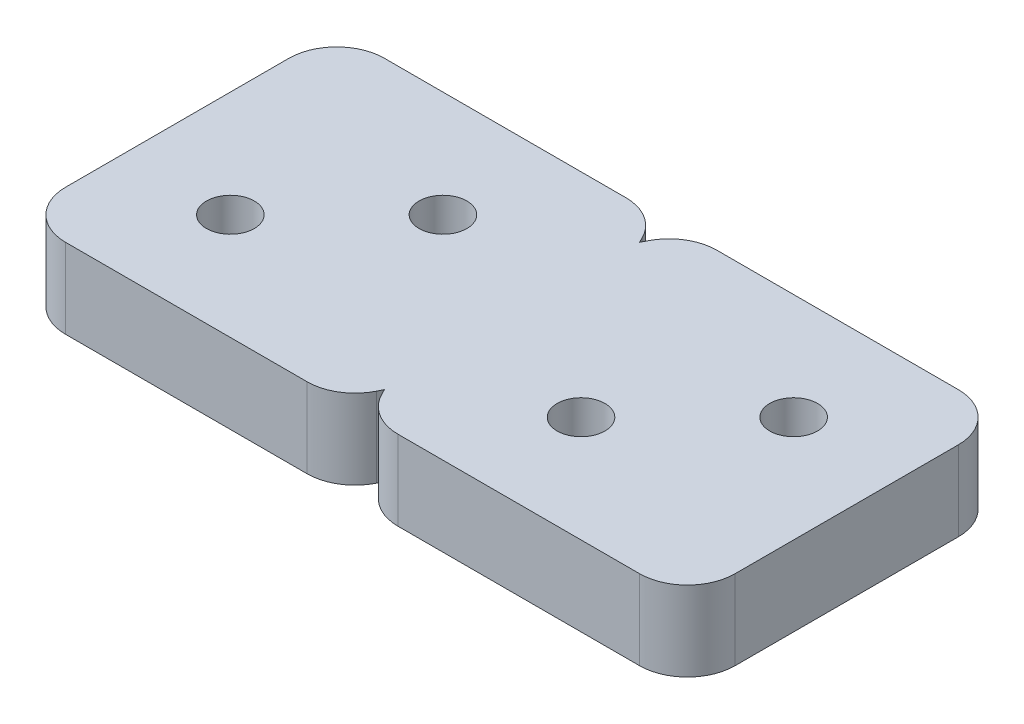
from build123d import *

# Parameters (mm, degrees)
SKETCH1_R           = 1.905
BOSS_EXTRUDE1_DEPTH = 6.35
FILLET1_R           = 3.81


with BuildPart() as part:
    # Sketch1 → Boss-Extrude1 (new body)
    with BuildSketch(Plane(origin=(0, 0, 0), x_dir=(1, 0, 0), z_dir=(0, 1, 0))):
        Polygon((-51.164237676, -4.231087287), (-51.164237676, -29.631087287), (-25.764237676, -29.631087287), (-24.494237676, -27.091087287), (-23.224237676, -29.631087287), (2.175762324, -29.631087287), (2.175762324, -4.231087287), (-23.224237676, -4.231087287), (-24.494237676, -6.771087287), (-25.764237676, -4.231087287), align=None)
        with Locations(Location((-42.698849573, -21.165699184, 0), (0, 0, 270))):
            Circle(SKETCH1_R, mode=Mode.SUBTRACT)
        with Locations(Location((-34.22962578, -12.696475391, 0), (0, 0, 270))):
            Circle(SKETCH1_R, mode=Mode.SUBTRACT)
        with Locations(Location((-14.758849573, -21.165699184, 0), (0, 0, 270))):
            Circle(SKETCH1_R, mode=Mode.SUBTRACT)
        with Locations(Location((-6.28962578, -12.696475391, 0), (0, 0, 270))):
            Circle(SKETCH1_R, mode=Mode.SUBTRACT)
    extrude(amount=BOSS_EXTRUDE1_DEPTH)

    # Fillet1
    fillet1_edges = [part.edges().sort_by_distance(p)[0] for p in [
        (-51.164237676, 3.175, 29.631087287),
        (-51.164237676, 3.175, 4.231087287),
        (-25.764237676, 3.175, 4.231087287),
        (-23.224237676, 3.175, 4.231087287),
        (2.175762324, 3.175, 4.231087287),
        (2.175762324, 3.175, 29.631087287),
        (-23.224237676, 3.175, 29.631087287),
        (-25.764237676, 3.175, 29.631087287),
    ]]
    fillet(fillet1_edges, radius=FILLET1_R)


solid = part.part
